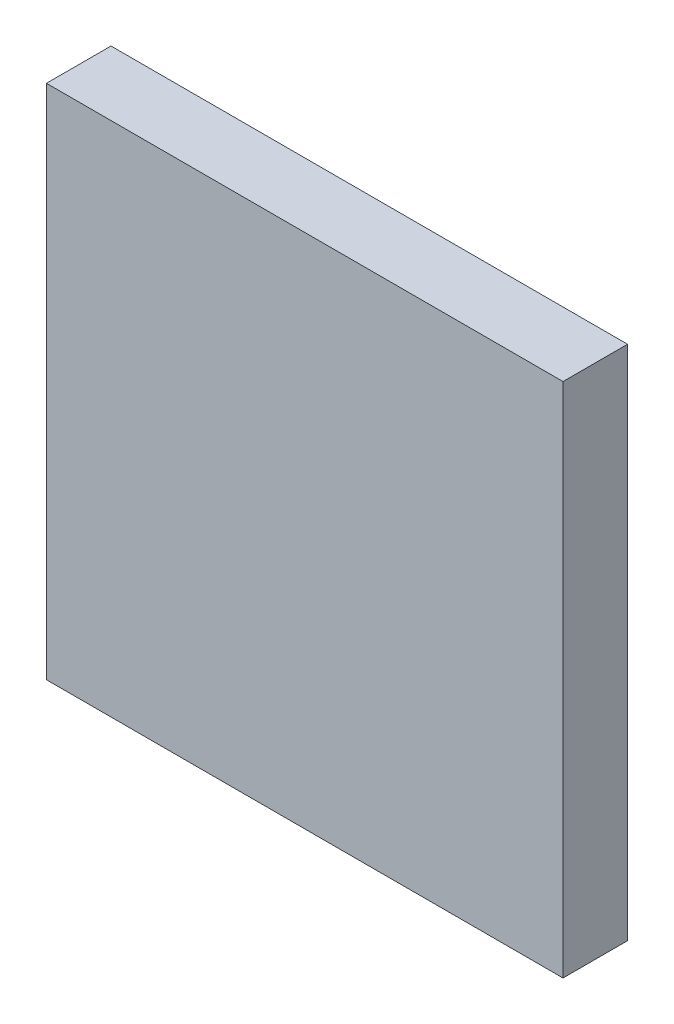
from build123d import *

# Parameters (mm, degrees)
SKETCH1_W           = 25.4
SKETCH1_H           = 25.4
BOSS_EXTRUDE1_DEPTH = 3.175


with BuildPart() as part:
    # Sketch1 → Boss-Extrude1 (new body)
    with BuildSketch(Plane.XY):
        with Locations((-12.7, 12.7)):
            Rectangle(SKETCH1_W, SKETCH1_H)
    extrude(amount=BOSS_EXTRUDE1_DEPTH)


solid = part.part
